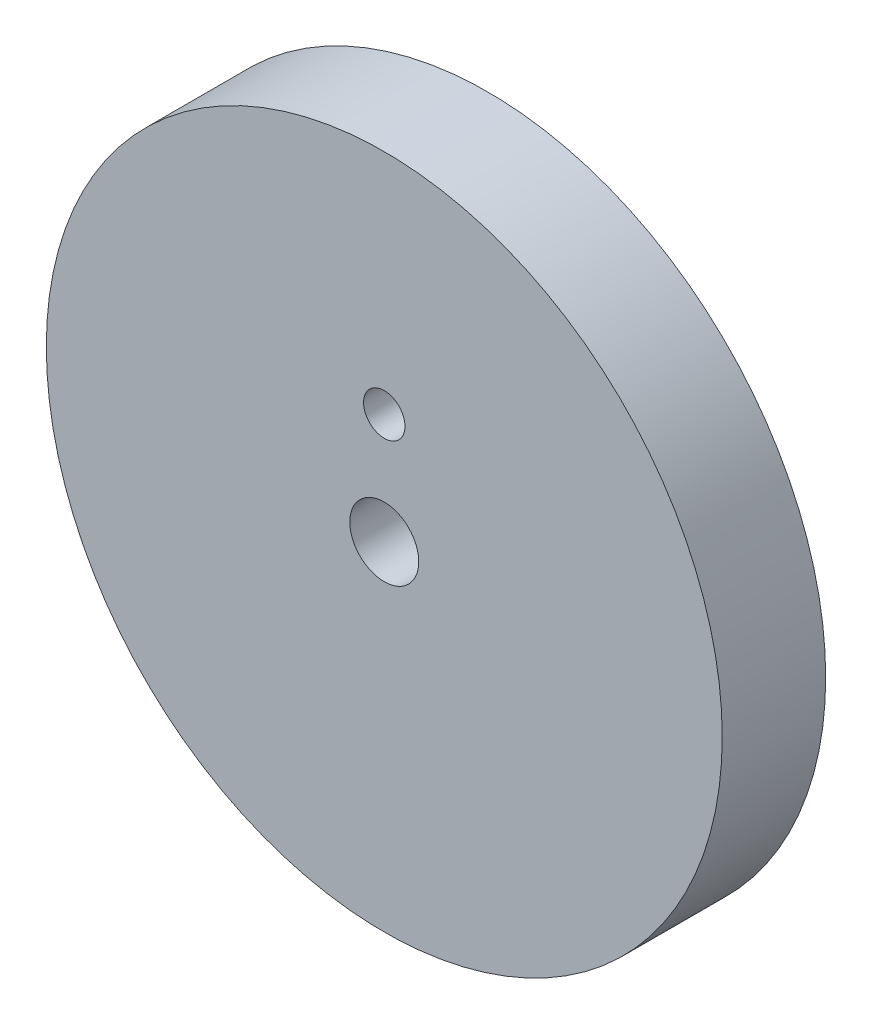
from build123d import *

# Parameters (mm, degrees)
ESQUISSE1_R             = 49
BOSS_EXTRU_1_DEPTH      = 15
ESQUISSE2_R             = 5
ESQUISSE2_R_2           = 3
ENL_V_MAT_EXTRU_1_DEPTH = 71.901339903


with BuildPart() as part:
    # Esquisse1 → Boss.-Extru.1 (new body)
    with BuildSketch(Plane.XY):
        Circle(ESQUISSE1_R)
    extrude(amount=BOSS_EXTRU_1_DEPTH)

    # Esquisse2 → Enlèv. mat.-Extru.1 (cut, through all)
    with BuildSketch(Plane(origin=(0, 0, 0), x_dir=(-1, 0, 0), z_dir=(0, 0, -1))):
        Circle(ESQUISSE2_R)
        with Locations((0, 16)):
            Circle(ESQUISSE2_R_2)
    extrude(amount=-ENL_V_MAT_EXTRU_1_DEPTH, mode=Mode.SUBTRACT)


solid = part.part
